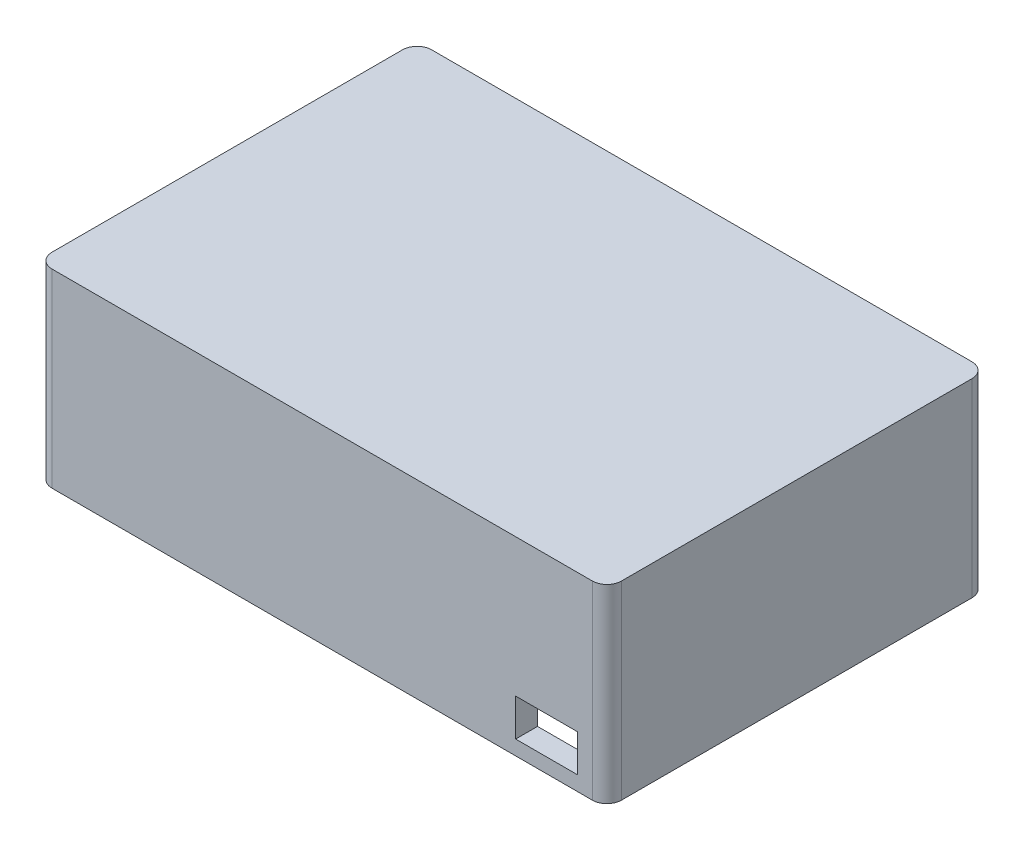
from build123d import *

# Parameters (mm, degrees)
SKETCH1_W           = 99.06
SKETCH1_H           = 66.04
BOSS_EXTRUDE1_DEPTH = 33.02
FILLET1_R           = 2.54
SKETCH3_W           = 91.44
SKETCH3_H           = 58.42
CUT_EXTRUDE1_DEPTH  = 30.48
BOSS_EXTRUDE2_REACH = 74.131
SKETCH4_R           = 1.190625
CUT_EXTRUDE5_DEPTH  = 12.7
CUT_EXTRUDE4_REACH  = 92.093
SKETCH6_W           = 10.795
SKETCH6_H           = 6.477


with BuildPart() as part:
    # Sketch1 → Boss-Extrude1 (new body)
    with BuildSketch(Plane(origin=(0, 0, 0), x_dir=(1, 0, 0), z_dir=(0, 1, 0))):
        with Locations((-2.094797048, -5.024935424)):
            Rectangle(SKETCH1_W, SKETCH1_H)
    extrude(amount=BOSS_EXTRUDE1_DEPTH)

    # Fillet1
    fillet1_edges = [part.edges().sort_by_distance(p)[0] for p in [
        (-51.624797048, 16.51, -27.995064576),
        (47.435202952, 16.51, -27.995064576),
        (47.435202952, 16.51, 38.044935424),
        (-51.624797048, 16.51, 38.044935424),
    ]]
    fillet(fillet1_edges, radius=FILLET1_R)

    # Sketch3 → Cut-Extrude1 (cut)
    with BuildSketch(Plane.XZ):
        with Locations((-2.094797048, 5.024935424)):
            Rectangle(SKETCH3_W, SKETCH3_H)
    extrude(amount=-CUT_EXTRUDE1_DEPTH, mode=Mode.SUBTRACT)

    # Sketch7 → Boss-Extrude2 (add, up to next)
    with BuildSketch(Plane.XZ, mode=Mode.PRIVATE) as boss_extrude2_sk1:
        with BuildLine():
            Line((43.625202952, 34.234935424), (41.085202952, 34.234935424))
            ThreePointArc((41.085202952, 34.234935424), (41.829151728, 32.4388842), (43.625202952, 31.694935424))
            Line((43.625202952, 31.694935424), (43.625202952, 34.234935424))
        make_face()
    boss_extrude2_tool1 = extrude(boss_extrude2_sk1.sketch, amount=-BOSS_EXTRUDE2_REACH, mode=Mode.PRIVATE) - part.part
    # Sketch7 → Boss-Extrude2 (add, up to next)
    with BuildSketch(Plane.XZ, mode=Mode.PRIVATE) as boss_extrude2_sk2:
        with BuildLine():
            Line((-47.814797048, 34.234935424), (-45.274797048, 34.234935424))
            ThreePointArc((-45.274797048, 34.234935424), (-46.018745824, 32.4388842), (-47.814797048, 31.694935424))
            Line((-47.814797048, 31.694935424), (-47.814797048, 34.234935424))
        make_face()
    boss_extrude2_tool2 = extrude(boss_extrude2_sk2.sketch, amount=-BOSS_EXTRUDE2_REACH, mode=Mode.PRIVATE) - part.part
    # Sketch7 → Boss-Extrude2 (add, up to next)
    with BuildSketch(Plane.XZ, mode=Mode.PRIVATE) as boss_extrude2_sk3:
        with BuildLine():
            Line((-47.814797048, -21.645064576), (-47.814797048, -24.185064576))
            Line((-47.814797048, -24.185064576), (-45.274797048, -24.185064576))
            ThreePointArc((-45.274797048, -24.185064576), (-46.018745824, -22.389013351), (-47.814797048, -21.645064576))
        make_face()
    boss_extrude2_tool3 = extrude(boss_extrude2_sk3.sketch, amount=-BOSS_EXTRUDE2_REACH, mode=Mode.PRIVATE) - part.part
    # Sketch7 → Boss-Extrude2 (add, up to next)
    with BuildSketch(Plane.XZ, mode=Mode.PRIVATE) as boss_extrude2_sk4:
        with BuildLine():
            Line((41.085202952, -24.185064576), (43.625202952, -24.185064576))
            Line((43.625202952, -24.185064576), (43.625202952, -21.645064576))
            ThreePointArc((43.625202952, -21.645064576), (41.829151728, -22.389013351), (41.085202952, -24.185064576))
        make_face()
    boss_extrude2_tool4 = extrude(boss_extrude2_sk4.sketch, amount=-BOSS_EXTRUDE2_REACH, mode=Mode.PRIVATE) - part.part
    add(boss_extrude2_tool1.solids().sort_by_distance((42.547193, 0, 33.156926))[0])
    add(boss_extrude2_tool2.solids().sort_by_distance((-46.736788, 0, 33.156926))[0])
    add(boss_extrude2_tool3.solids().sort_by_distance((-46.736788, 0, -23.107055))[0])
    add(boss_extrude2_tool4.solids().sort_by_distance((42.547193, 0, -23.107055))[0])

    # Sketch4 → Cut-Extrude5 (cut)
    with BuildSketch(Plane.XZ):
        with Locations(Location((44.260202952, 34.869935424, 0), (0, 0, 270))):
            Circle(SKETCH4_R)
        with Locations(Location((44.260202952, -24.820064576, 0), (0, 0, 270))):
            Circle(SKETCH4_R)
        with Locations(Location((-48.449797048, 34.869935424, 0), (0, 0, 270))):
            Circle(SKETCH4_R)
        with Locations(Location((-48.449797048, -24.820064576, 0), (0, 0, 270))):
            Circle(SKETCH4_R)
    extrude(amount=-CUT_EXTRUDE5_DEPTH, mode=Mode.SUBTRACT)

    # Sketch6 → Cut-Extrude4 (cut, up to next)
    with BuildSketch(Plane.XY.offset(38.044935424), mode=Mode.PRIVATE) as cut_extrude4_sk1:
        with Locations((36.957702952, 5.7785)):
            Rectangle(SKETCH6_W, SKETCH6_H)
    cut_extrude4_tool1 = extrude(cut_extrude4_sk1.sketch, amount=-CUT_EXTRUDE4_REACH, mode=Mode.PRIVATE) & part.part
    add(cut_extrude4_tool1.solids().sort_by_distance((36.957703, 5.7785, 38.044935))[0], mode=Mode.SUBTRACT)


solid = part.part
